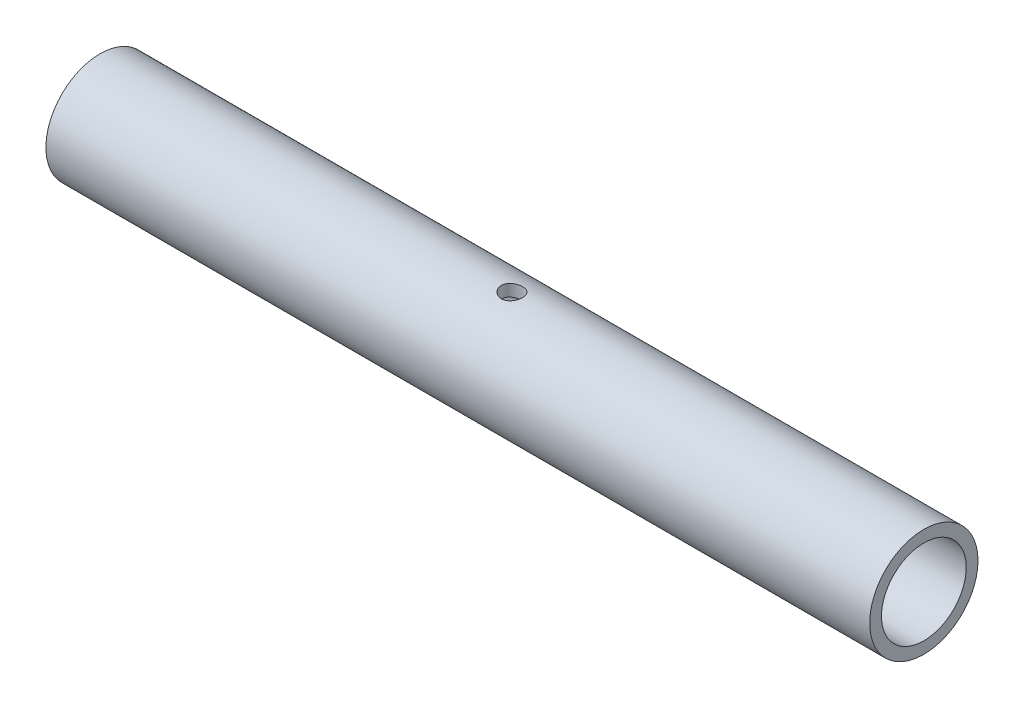
from build123d import *

# Parameters (mm, degrees)
SKETCH1_R               = 16.7005
SKETCH1_R_2             = 13.0683
BOSS_EXTRUDE1_DEPTH     = 254
CUT_EXTRUDE2_DEPTH      = 256.095694594
CUT_EXTRUDE2_DEPTH_BACK = 256.095694594
SKETCH3_R               = 3.2639


with BuildPart() as part:
    # Sketch1 → Boss-Extrude1 (new body)
    with BuildSketch(Plane(origin=(0, 0, 0), x_dir=(0, 0, -1), z_dir=(1, 0, 0))):
        Circle(SKETCH1_R)
        Circle(SKETCH1_R_2, mode=Mode.SUBTRACT)
    extrude(amount=BOSS_EXTRUDE1_DEPTH)

    # Sketch3 → Cut-Extrude2 (cut, two sides: drawn at the far end of the back side and taken through both)
    with BuildSketch(Plane(origin=(0, 0, 0), x_dir=(1, 0, 0), z_dir=(0, 1, 0)).offset(-CUT_EXTRUDE2_DEPTH_BACK)):
        with Locations(Location((127, 0, 0), (0, 0, 270))):
            Circle(SKETCH3_R)
    extrude(amount=CUT_EXTRUDE2_DEPTH + CUT_EXTRUDE2_DEPTH_BACK, mode=Mode.SUBTRACT)


solid = part.part
